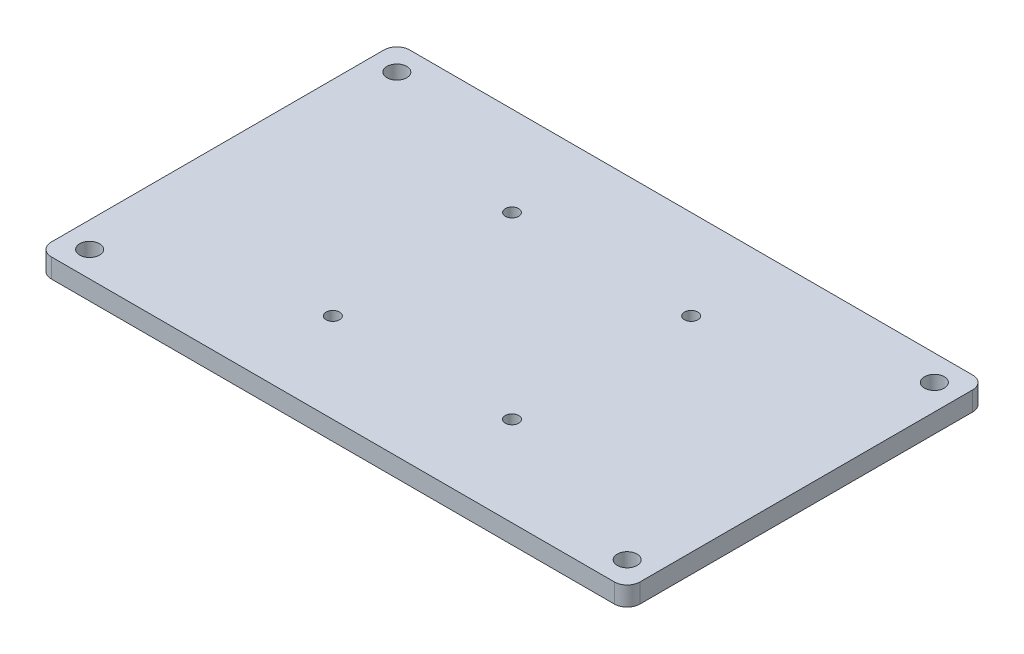
from build123d import *

# Parameters (mm, degrees)
SKETCH1_R           = 1.55
SKETCH1_R_2         = 1.05
BOSS_EXTRUDE1_DEPTH = 3


with BuildPart() as part:
    # Sketch1 → Boss-Extrude1 (new body)
    with BuildSketch(Plane(origin=(0, 0, 0), x_dir=(1, 0, 0), z_dir=(0, 1, 0))):
        with BuildLine():
            Line((-44, 28), (44, 28))
            ThreePointArc((44, 28), (45.414213562, 27.414213562), (46, 26))
            Line((46, 26), (46, -26))
            ThreePointArc((46, -26), (45.414213562, -27.414213562), (44, -28))
            Line((44, -28), (-44, -28))
            ThreePointArc((-44, -28), (-45.414213562, -27.414213562), (-46, -26))
            Line((-46, -26), (-46, 26))
            ThreePointArc((-46, 26), (-45.414213562, 27.414213562), (-44, 28))
        make_face()
        with Locations(Location((42, 24, 0), (0, 0, 270))):
            Circle(SKETCH1_R, mode=Mode.SUBTRACT)
        with Locations(Location((-42, 24, 0), (0, 0, 90))):
            Circle(SKETCH1_R, mode=Mode.SUBTRACT)
        with Locations(Location((42, -24, 0), (0, 0, 90))):
            Circle(SKETCH1_R, mode=Mode.SUBTRACT)
        with Locations(Location((-42, -24, 0), (0, 0, 270))):
            Circle(SKETCH1_R, mode=Mode.SUBTRACT)
        with Locations(Location((14, 14, 0), (0, 0, 270))):
            Circle(SKETCH1_R_2, mode=Mode.SUBTRACT)
        with Locations(Location((14, -14, 0), (0, 0, 90))):
            Circle(SKETCH1_R_2, mode=Mode.SUBTRACT)
        with Locations(Location((-14, 14, 0), (0, 0, 90))):
            Circle(SKETCH1_R_2, mode=Mode.SUBTRACT)
        with Locations(Location((-14, -14, 0), (0, 0, 270))):
            Circle(SKETCH1_R_2, mode=Mode.SUBTRACT)
    extrude(amount=BOSS_EXTRUDE1_DEPTH)


solid = part.part
